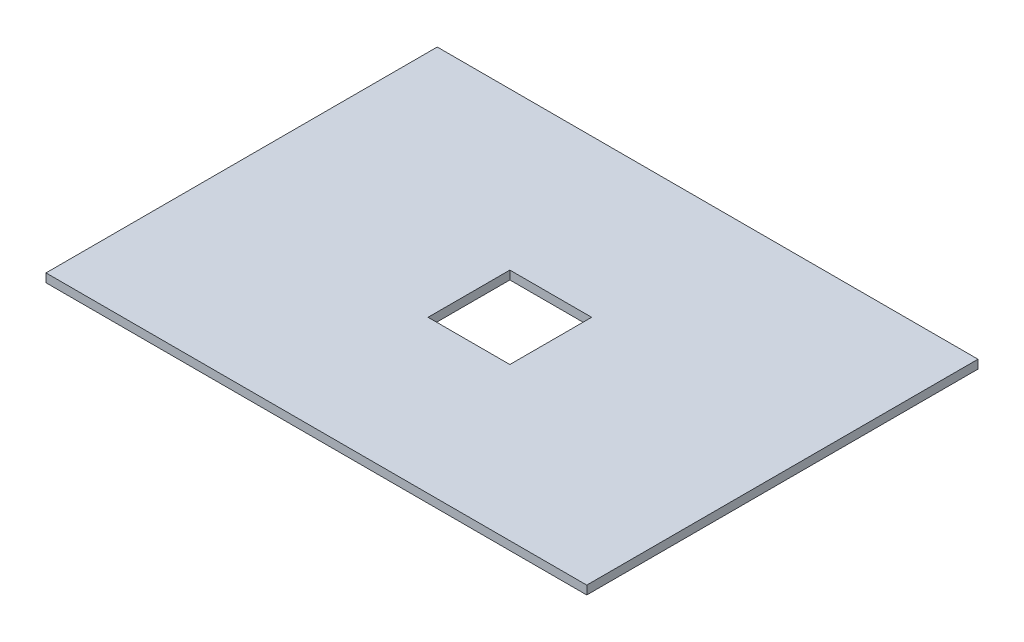
from build123d import *

# Parameters (mm, degrees)
SKETCH1_W           = 60.5
SKETCH1_H           = 60.5
BOSS_EXTRUDE1_DEPTH = 6.35


with BuildPart() as part:
    # Sketch1 → Boss-Extrude1 (new body)
    with BuildSketch(Plane(origin=(0, 0, 0), x_dir=(1, 0, 0), z_dir=(0, 1, 0))):
        Polygon((13.7, 289.4), (386.3, 289.4), (393.65, 289.4), (400, 289.4), (400, 0), (0, 0), (0, 289.4), (6.35, 289.4), align=None)
        with Locations((200, 143.11)):
            Rectangle(SKETCH1_W, SKETCH1_H, mode=Mode.SUBTRACT)
    extrude(amount=BOSS_EXTRUDE1_DEPTH)


solid = part.part
